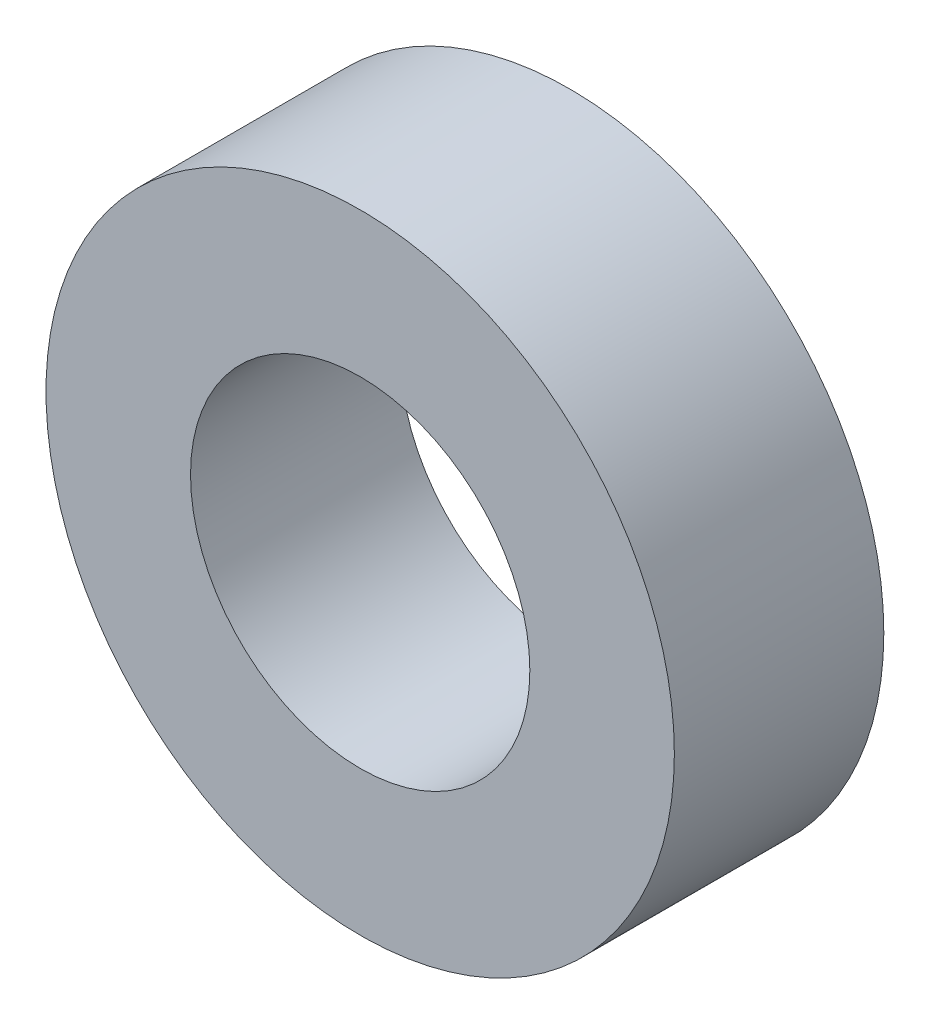
from build123d import *

# Parameters (mm, degrees)
SKETCH1_R           = 7.5
SKETCH1_R_2         = 4.05
BOSS_EXTRUDE1_DEPTH = 5


with BuildPart() as part:
    # Sketch1 → Boss-Extrude1 (new body)
    with BuildSketch(Plane.XY):
        Circle(SKETCH1_R)
        Circle(SKETCH1_R_2, mode=Mode.SUBTRACT)
    extrude(amount=BOSS_EXTRUDE1_DEPTH)


solid = part.part
